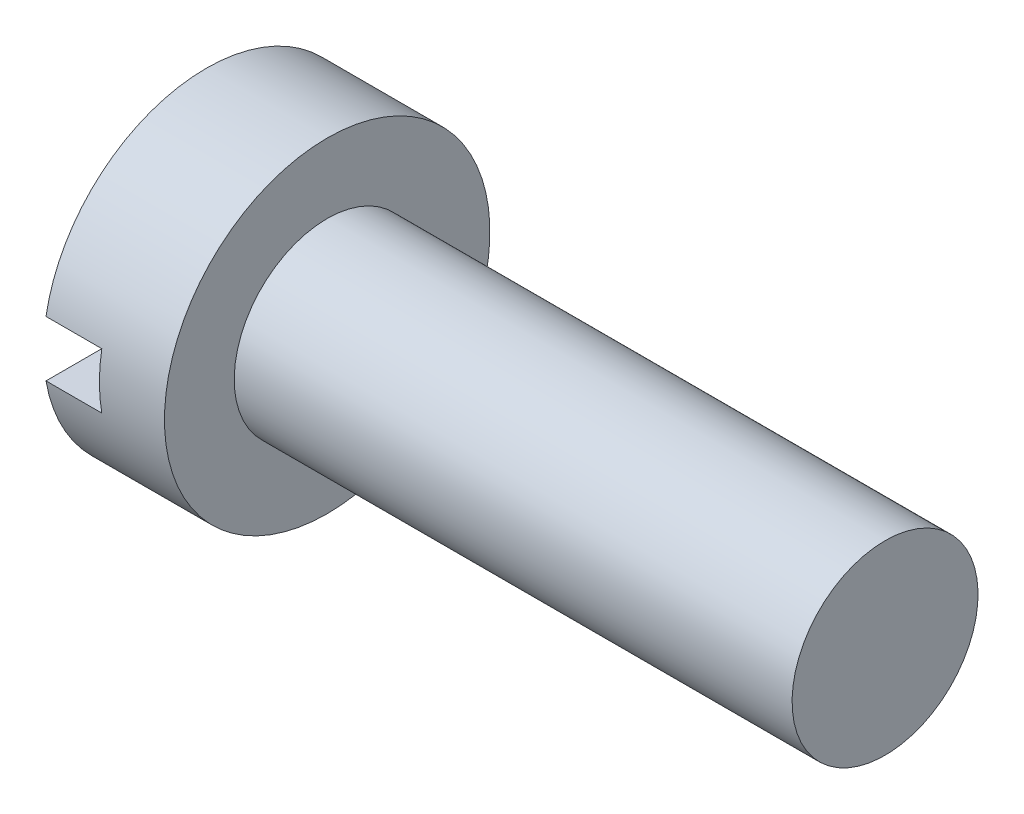
from build123d import *

# Parameters (mm, degrees)
SKETCH2_W          = 7
SKETCH2_H          = 1.2
CUT_EXTRUDE1_DEPTH = 1.2


with BuildPart() as part:
    # Sketch1 → Revolve1 (revolve)
    with BuildSketch(Plane.XY):
        Polygon((0, 0), (0, 3.5), (2.6, 3.5), (2.6, 2), (14.6, 2), (14.6, 0), align=None)
    revolve(axis=Axis((14.6, 0, 0), (-1, 0, 0)))

    # Sketch2 → Cut-Extrude1 (cut)
    with BuildSketch(Plane.ZY):
        Rectangle(SKETCH2_W, SKETCH2_H)
    extrude(amount=-CUT_EXTRUDE1_DEPTH, mode=Mode.SUBTRACT)


solid = part.part
